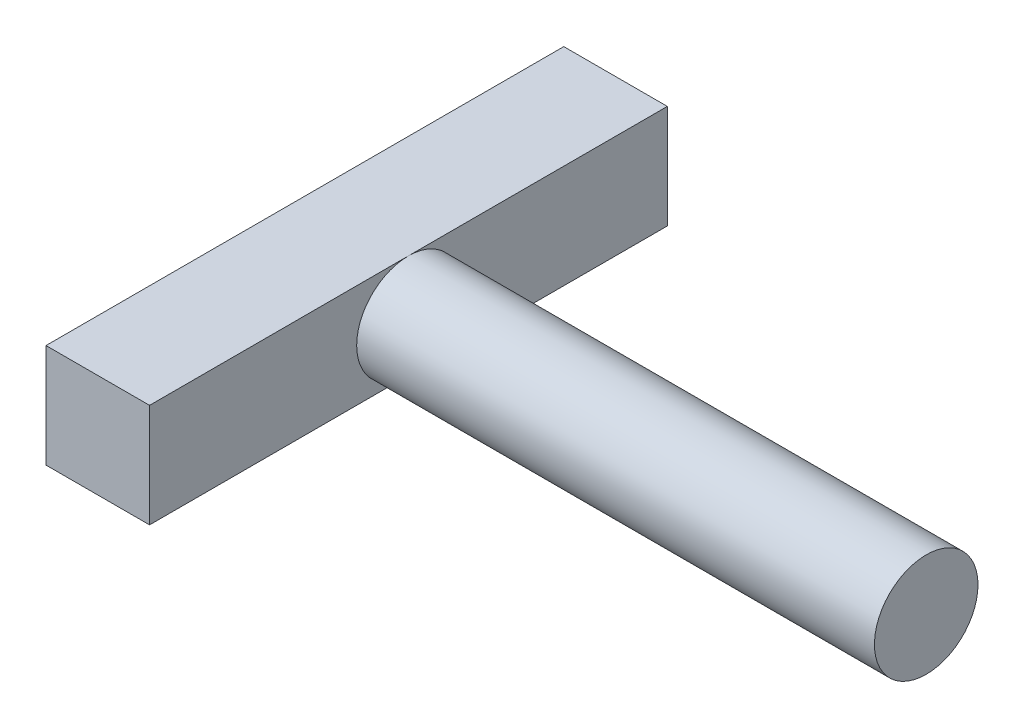
from build123d import *

# Parameters (mm, degrees)
SKETCH1_W           = 25.4
SKETCH1_H           = 25.4
BOSS_EXTRUDE1_DEPTH = 127
SKETCH2_R           = 12.7
BOSS_EXTRUDE2_DEPTH = 127


with BuildPart() as part:
    # Sketch1 → Boss-Extrude1 (new body)
    with BuildSketch(Plane.XY):
        Rectangle(SKETCH1_W, SKETCH1_H)
    extrude(amount=BOSS_EXTRUDE1_DEPTH)

    # Sketch2 → Boss-Extrude2 (add)
    with BuildSketch(Plane(origin=(12.7, 0, 0), x_dir=(0, 0, -1), z_dir=(1, 0, 0))):
        with Locations(Location((-63.5, 0, 0), (0, 0, 270))):
            Circle(SKETCH2_R)
    extrude(amount=BOSS_EXTRUDE2_DEPTH)


solid = part.part
